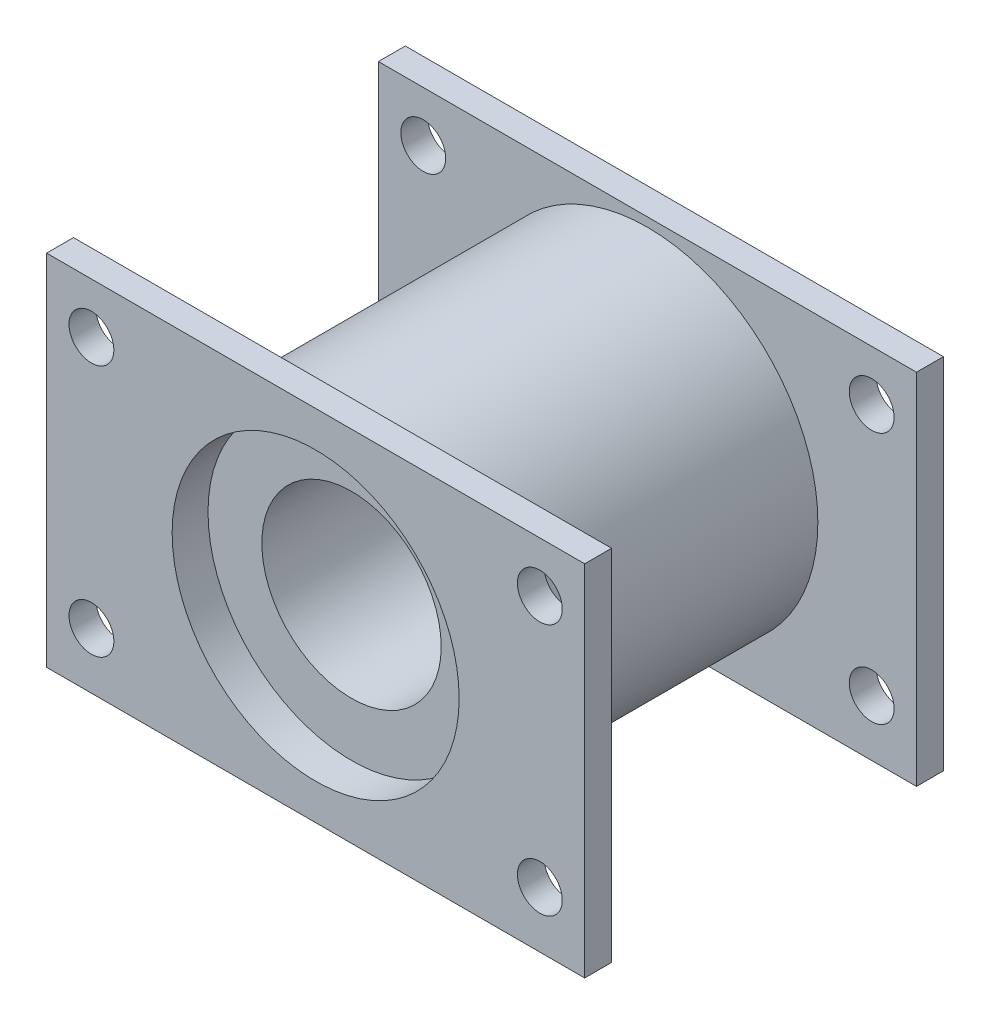
from build123d import *

# Parameters (mm, degrees)
SKETCH1_R                = 19
SKETCH1_R_2              = 16
BOSS_EXTRUDE1_DEPTH      = 40
SKETCH2_W                = 60
SKETCH2_H                = 40
SKETCH2_R                = 19
BOSS_EXTRUDE2_DEPTH      = 3
SKETCH4_R                = 2.5
CUT_EXTRUDE1_DEPTH       = 54.851648071
BOSS_EXTRUDE3_DEPTH      = 16
BOSS_EXTRUDE3_DEPTH_BACK = 16
SKETCH6_R                = 16
SKETCH6_R_2              = 10


with BuildPart() as part:
    # Sketch1 → Boss-Extrude1 (new body)
    with BuildSketch(Plane.XY):
        Circle(SKETCH1_R)
        Circle(SKETCH1_R_2, mode=Mode.SUBTRACT)
    extrude(amount=BOSS_EXTRUDE1_DEPTH)

    # Sketch2 → Boss-Extrude2 (add)
    with BuildSketch(Plane(origin=(0, 0, 0), x_dir=(-1, 0, 0), z_dir=(0, 0, -1))):
        Rectangle(SKETCH2_W, SKETCH2_H)
        Circle(SKETCH2_R, mode=Mode.SUBTRACT)
    boss_extrude2 = extrude(amount=-BOSS_EXTRUDE2_DEPTH)

    # Mirror1: Boss-Extrude2 across plane
    add(boss_extrude2.mirror(Plane.XY.offset(20)))

    # Sketch4 → Cut-Extrude1 (cut, through all)
    with BuildSketch(Plane(origin=(0, 0, 0), x_dir=(-1, 0, 0), z_dir=(0, 0, -1))):
        with Locations((-25, 14.38623609)):
            Circle(SKETCH4_R)
        with Locations((25, 14.38623609)):
            Circle(SKETCH4_R)
        with Locations((-25, -13.739663681)):
            Circle(SKETCH4_R)
        with Locations((25, -13.739663681)):
            Circle(SKETCH4_R)
    extrude(amount=-CUT_EXTRUDE1_DEPTH, mode=Mode.SUBTRACT)

    # Sketch6 → Boss-Extrude3 (add, two sides: drawn at the far end of the back side and taken through both)
    with BuildSketch(Plane.XY.offset(20).offset(-BOSS_EXTRUDE3_DEPTH_BACK)):
        Circle(SKETCH6_R)
        Circle(SKETCH6_R_2, mode=Mode.SUBTRACT)
    extrude(amount=BOSS_EXTRUDE3_DEPTH + BOSS_EXTRUDE3_DEPTH_BACK)


solid = part.part
